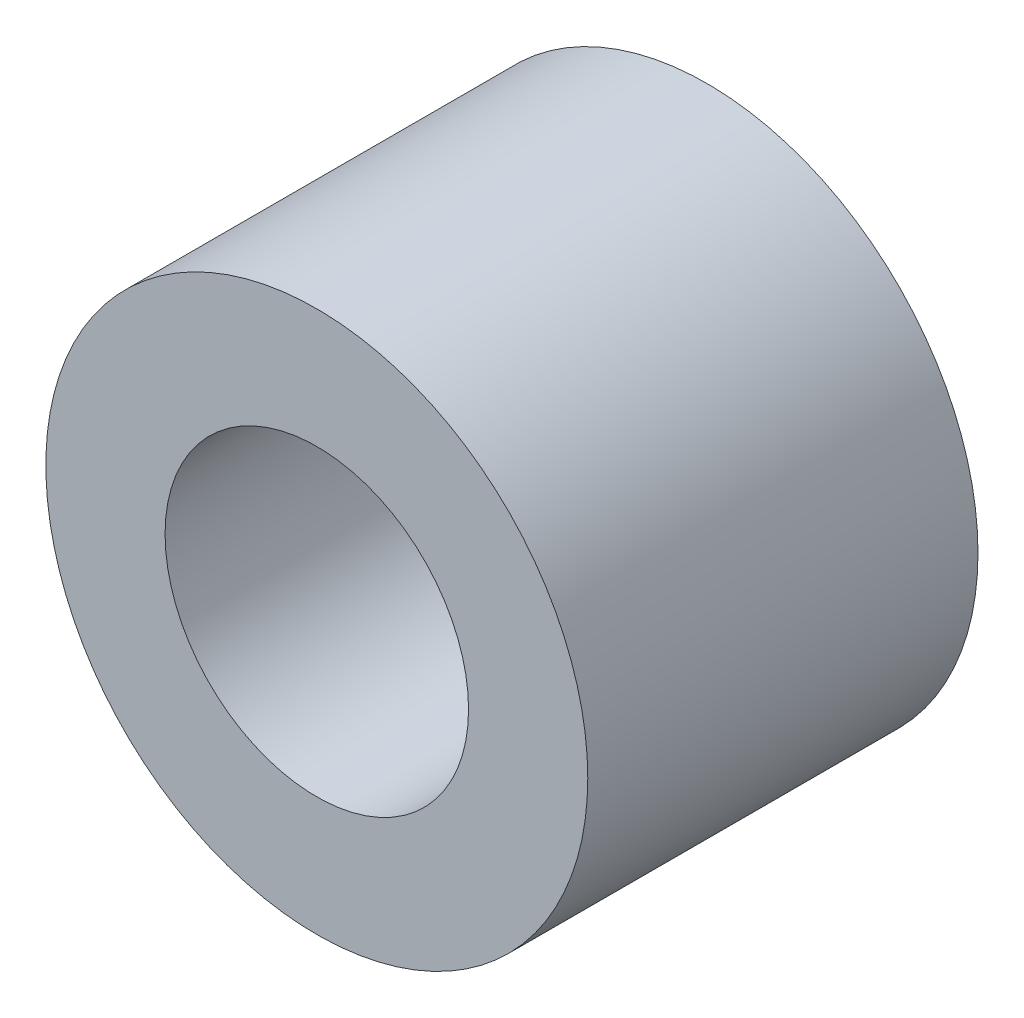
from build123d import *

# Parameters (mm, degrees)
SKETCH1_R           = 8.73125
SKETCH1_R_2         = 4.8895
BOSS_EXTRUDE1_DEPTH = 12.573


with BuildPart() as part:
    # Sketch1 → Boss-Extrude1 (new body)
    with BuildSketch(Plane.XY):
        Circle(SKETCH1_R)
        Circle(SKETCH1_R_2, mode=Mode.SUBTRACT)
    extrude(amount=BOSS_EXTRUDE1_DEPTH)


solid = part.part
